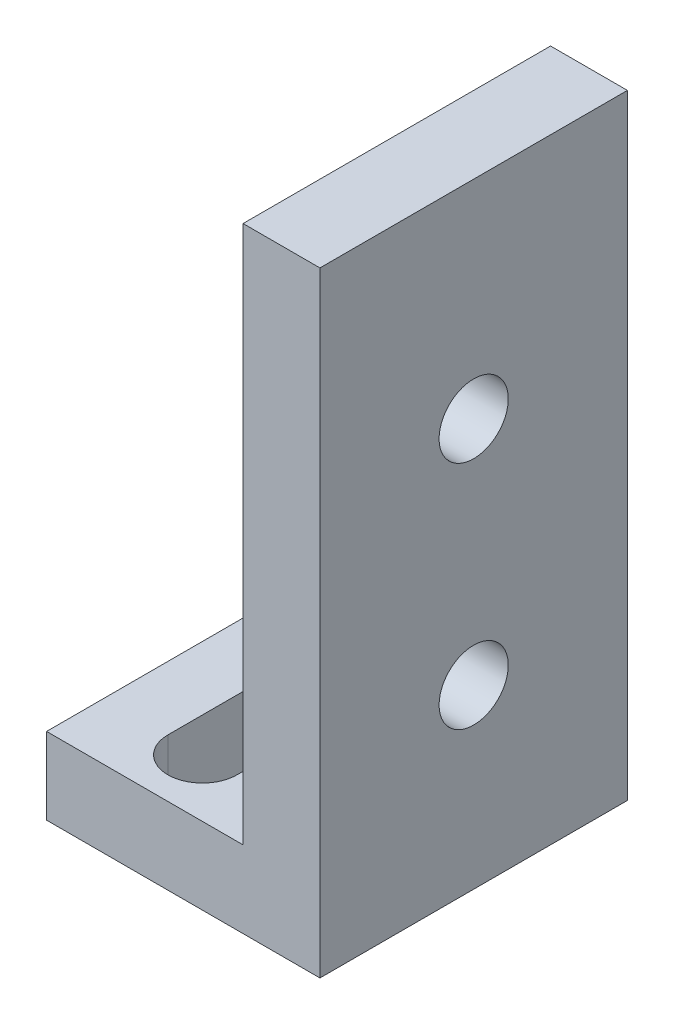
from build123d import *

# Parameters (mm, degrees)
RESSALTO_EXTRUS_O1_DEPTH = 20
CORTE_EXTRUS_O1_DEPTH    = 45.05823873
ESBO_O3_R                = 2.25
CORTE_EXTRUS_O2_DEPTH    = 47.511594253


with BuildPart() as part:
    # Esboço1 → Ressalto-extrusão1 (new body)
    with BuildSketch(Plane.XY):
        Polygon((0, 0), (0, 5), (12.78, 5), (12.78, 40), (17.78, 40), (17.78, 0), align=None)
    extrude(amount=RESSALTO_EXTRUS_O1_DEPTH)

    # Esboço2 → Corte-extrusão1 (cut, through all)
    with BuildSketch(Plane(origin=(0, 5, 0), x_dir=(1, 0, 0), z_dir=(0, 1, 0))):
        with BuildLine():
            Line((8.64, -3.75), (8.64, -16.25))
            ThreePointArc((8.64, -16.25), (6.39, -18.5), (4.14, -16.25))
            Line((4.14, -16.25), (4.14, -3.75))
            ThreePointArc((4.14, -3.75), (6.39, -1.5), (8.64, -3.75))
        make_face()
    extrude(amount=-CORTE_EXTRUS_O1_DEPTH, mode=Mode.SUBTRACT)

    # Esboço3 → Corte-extrusão2 (cut, through all)
    with BuildSketch(Plane.ZY.offset(-12.78)):
        with Locations((10, 26.5)):
            Circle(ESBO_O3_R)
        with Locations((10, 11.5)):
            Circle(ESBO_O3_R)
    extrude(amount=-CORTE_EXTRUS_O2_DEPTH, mode=Mode.SUBTRACT)


solid = part.part
